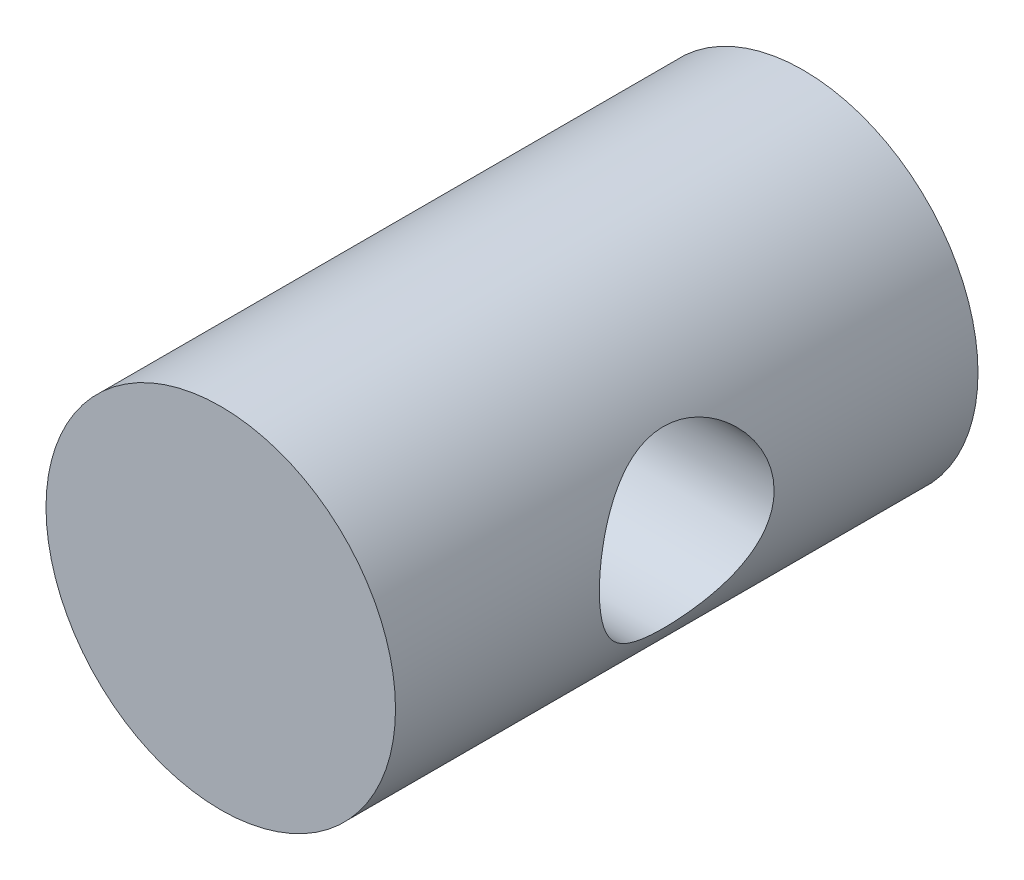
from build123d import *

# Parameters (mm, degrees)
SKETCH1_R               = 3
BOSS_EXTRUDE1_DEPTH     = 10
CUT_EXTRUDE1_DEPTH      = 10
CUT_EXTRUDE1_DEPTH_BACK = 10
SKETCH2_R               = 1.5


with BuildPart() as part:
    # Sketch1 → Boss-Extrude1 (new body)
    with BuildSketch(Plane.XY):
        Circle(SKETCH1_R)
    extrude(amount=BOSS_EXTRUDE1_DEPTH)

    # Sketch2 → Cut-Extrude1 (cut, two sides: drawn at the far end of the back side and taken through both)
    with BuildSketch(Plane(origin=(0, 0, 0), x_dir=(0, 0, -1), z_dir=(1, 0, 0)).offset(-CUT_EXTRUDE1_DEPTH_BACK)):
        with Locations((-5, 0)):
            Circle(SKETCH2_R)
    extrude(amount=CUT_EXTRUDE1_DEPTH + CUT_EXTRUDE1_DEPTH_BACK, mode=Mode.SUBTRACT)


solid = part.part
